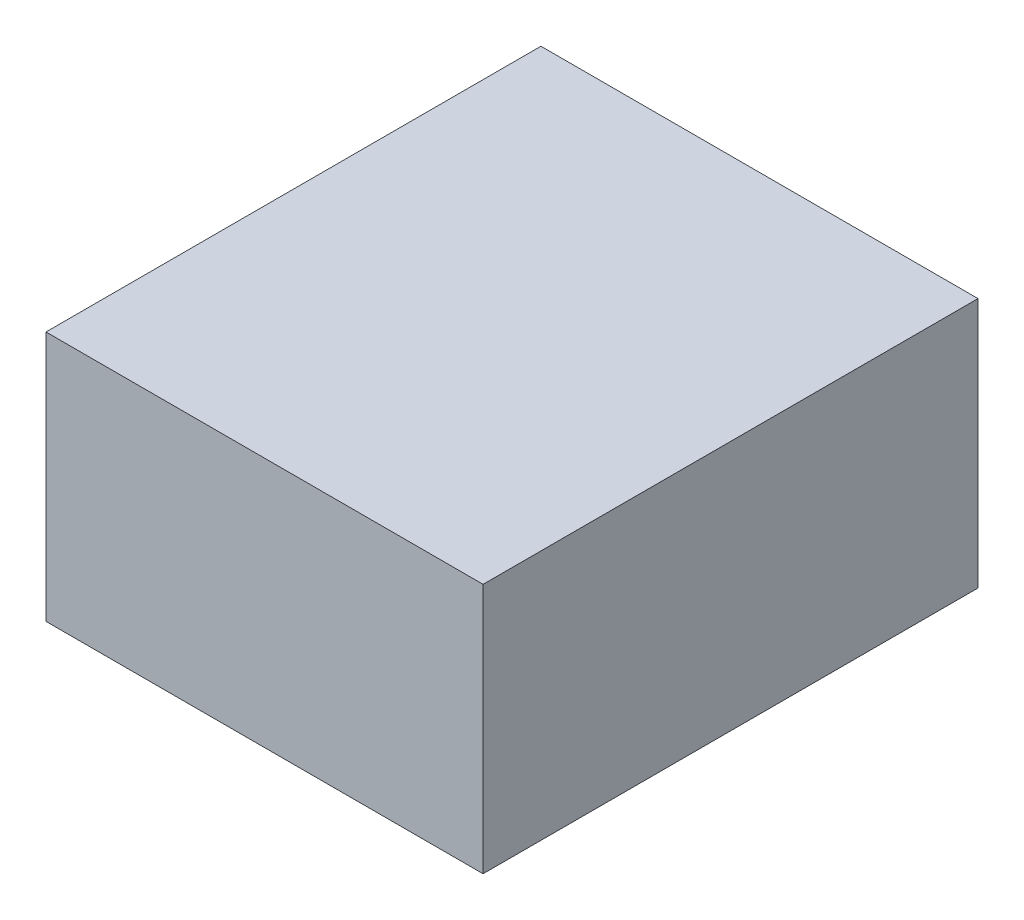
from build123d import *

# Parameters (mm, degrees)
SKETCH1_W           = 68
SKETCH1_H           = 39
BOSS_EXTRUDE1_DEPTH = 38.5


with BuildPart() as part:
    # Sketch1 → Boss-Extrude1 (new, symmetric)
    with BuildSketch(Plane.XY):
        Rectangle(SKETCH1_W, SKETCH1_H)
    extrude(amount=BOSS_EXTRUDE1_DEPTH, both=True)


solid = part.part
